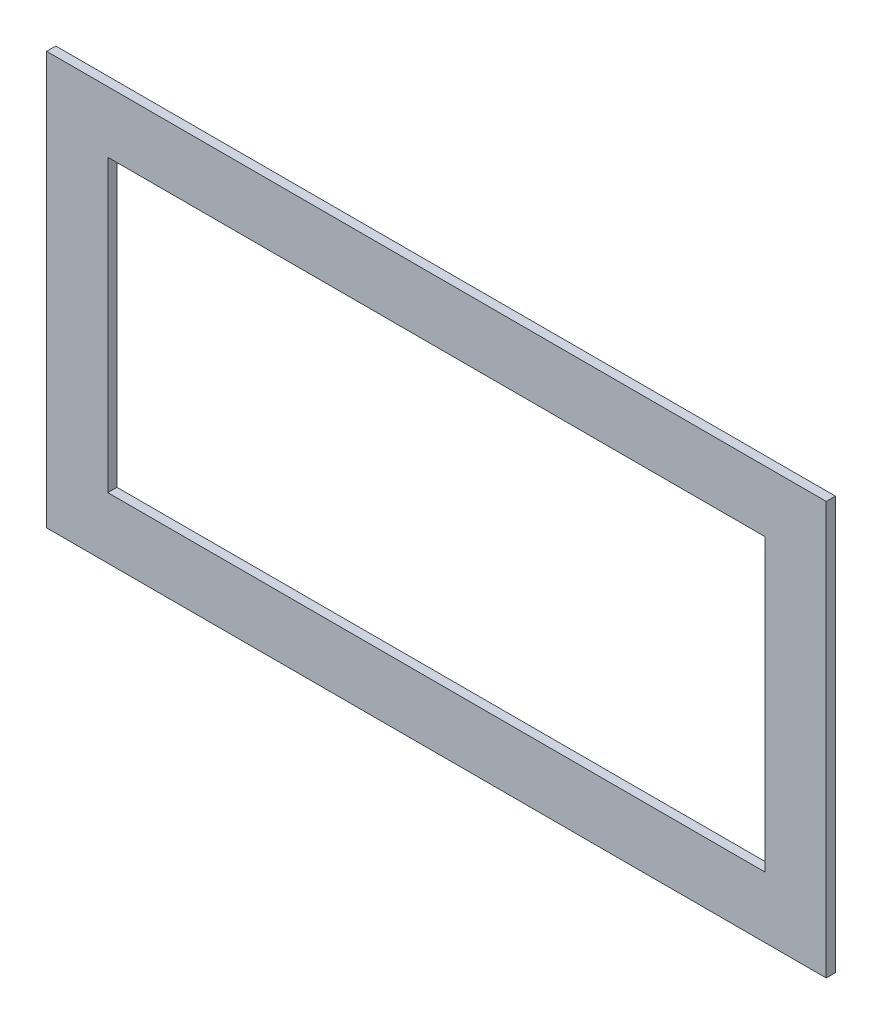
from build123d import *

# Parameters (mm, degrees)
SKETCH1_W           = 215
SKETCH1_H           = 95
BOSS_EXTRUDE1_DEPTH = 3


with BuildPart() as part:
    # Sketch1 → Boss-Extrude1 (new body)
    with BuildSketch(Plane.XY):
        Polygon((5, 130), (5, 127), (5, -2), (5, -5), (-250, -5), (-250, -2), (-250, 127), (-250, 130), align=None)
        with Locations((-122.5, 62.5)):
            Rectangle(SKETCH1_W, SKETCH1_H, mode=Mode.SUBTRACT)
    extrude(amount=BOSS_EXTRUDE1_DEPTH)


solid = part.part
